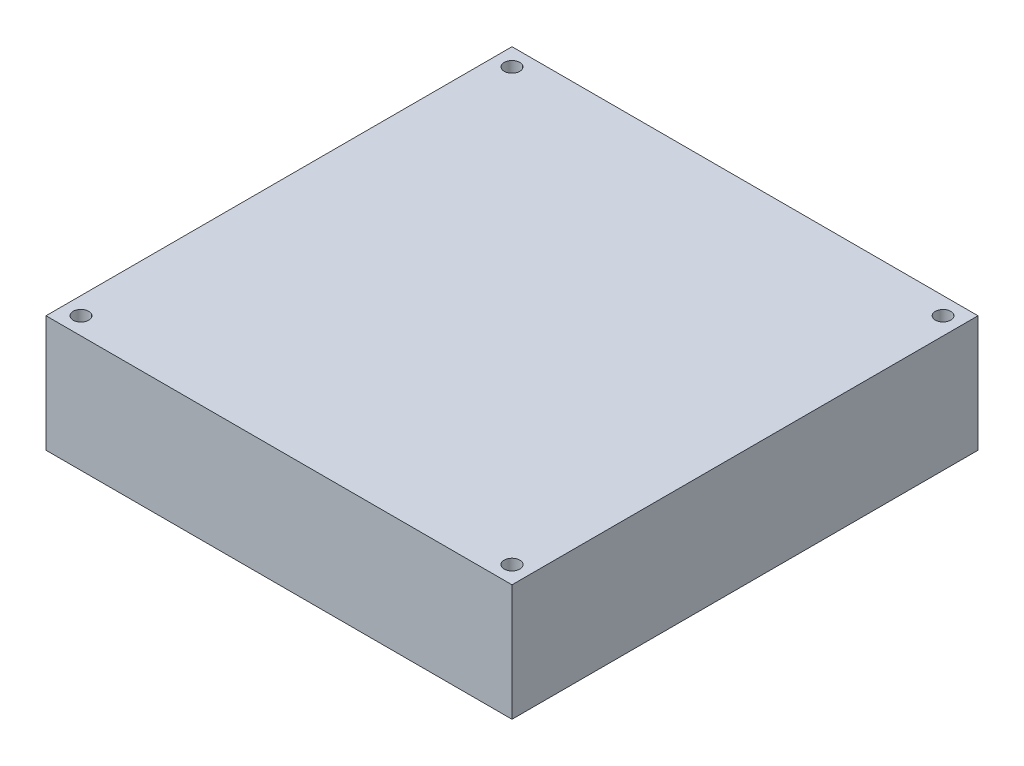
from build123d import *

# Parameters (mm, degrees)
SKETCH1_W           = 60
SKETCH1_H           = 60
BOSS_EXTRUDE1_DEPTH = 15
SKETCH3_R           = 1.001686447
SKETCH3_R_2         = 1.003205363
SKETCH3_R_3         = 0.990882211
SKETCH3_R_4         = 1.00895845
CUT_EXTRUDE1_DEPTH  = 87.168439698


with BuildPart() as part:
    # Sketch1 → Boss-Extrude1 (new body)
    with BuildSketch(Plane(origin=(0, 0, 0), x_dir=(1, 0, 0), z_dir=(0, 1, 0))):
        with Locations((-30, 30)):
            Rectangle(SKETCH1_W, SKETCH1_H)
    extrude(amount=BOSS_EXTRUDE1_DEPTH)

    # Sketch3 → Cut-Extrude1 (cut, through all)
    with BuildSketch(Plane(origin=(0, 15, 0), x_dir=(1, 0, 0), z_dir=(0, 1, 0))):
        with Locations(Location((-57.75, 2.25, 0), (0, 0, 270))):
            Circle(SKETCH3_R)
        with Locations(Location((-57.75, 57.75, 0), (0, 0, 270))):
            Circle(SKETCH3_R_2)
        with Locations(Location((-2.25, 57.75, 0), (0, 0, 270))):
            Circle(SKETCH3_R_3)
        with Locations(Location((-2.25, 2.25, 0), (0, 0, 270))):
            Circle(SKETCH3_R_4)
    extrude(amount=-CUT_EXTRUDE1_DEPTH, mode=Mode.SUBTRACT)


solid = part.part
